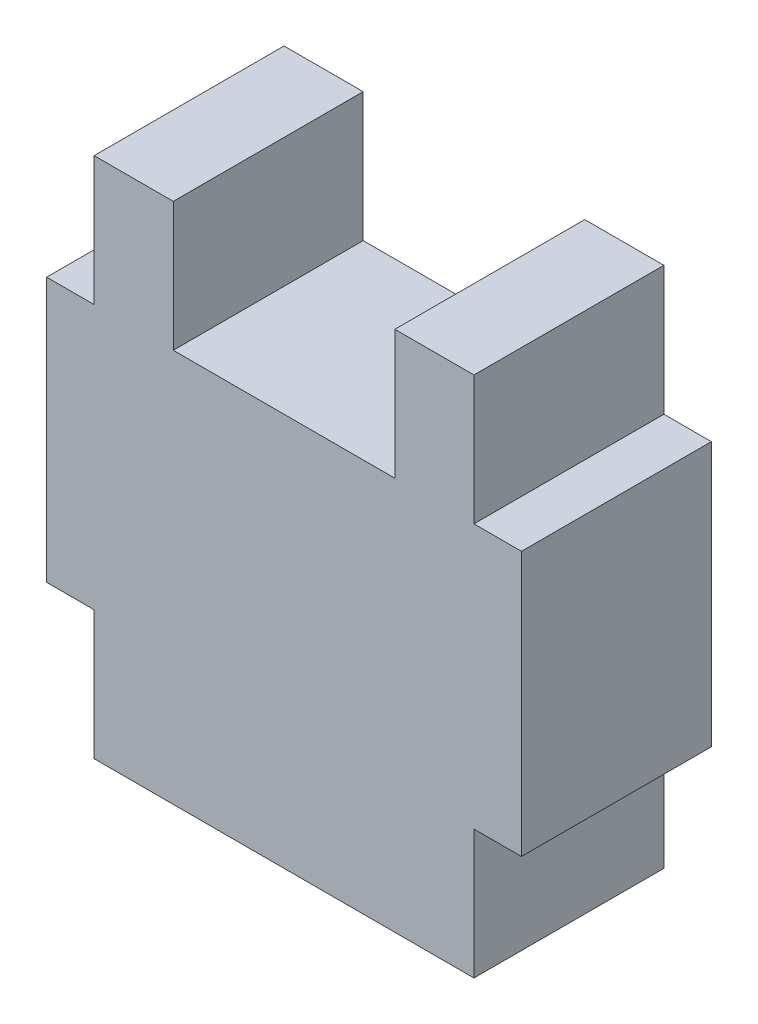
from build123d import *

# Parameters (mm, degrees)
COMPONENT_OUTLINE_DEPTH = 1.2


with BuildPart() as part:
    # 草图1 → Component_Outline (new body)
    with BuildSketch(Plane.XY):
        Polygon((-1.5, -0.835), (-1.2, -0.835), (-1.2, -1.65), (1.2, -1.65), (1.2, -0.835), (1.5, -0.835), (1.5, 0.835), (1.2, 0.835), (1.2, 1.65), (0.7, 1.65), (0.7, 0.835), (-0.7, 0.835), (-0.7, 1.65), (-1.2, 1.65), (-1.2, 0.835), (-1.5, 0.835), align=None)
    extrude(amount=COMPONENT_OUTLINE_DEPTH)


solid = part.part
